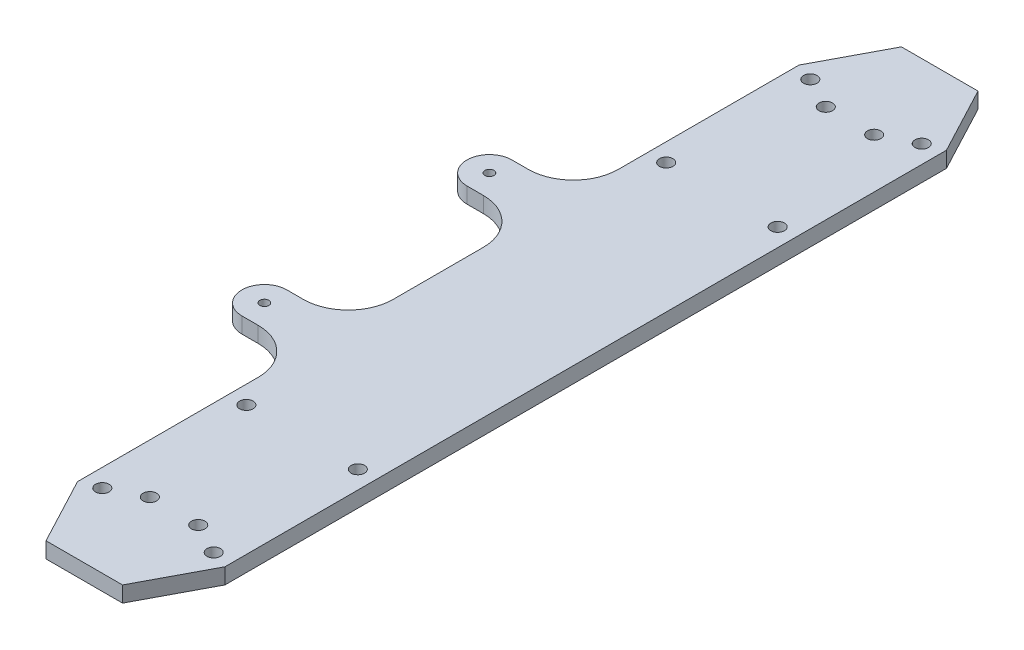
from build123d import *

# Parameters (mm, degrees)
SKETCH1_W               = 32.75
SKETCH1_H               = 190
BOSS_EXTRUDE1_DEPTH     = 3.5
SKETCH3_R               = 1.5
CUT_EXTRUDE1_DEPTH      = 97.46445265
MIRROR2_COPY_1_SKETCH_R = 1.5
MIRROR2_COPY_1_DEPTH    = 97.46445265
SKETCH4_R               = 1.5
CUT_EXTRUDE2_DEPTH      = 97.46445265
MIRROR4_COPY_1_SKETCH_R = 1.5
MIRROR4_COPY_1_DEPTH    = 97.46445265
BOSS_EXTRUDE2_DEPTH     = 3.5
FILLET1_R               = 10
FILLET2_R               = 10
FILLET5_R               = 10
FILLET6_R               = 10
MIRROR14_COPY_1_DEPTH   = 3.5
FILLET7_R               = 10
FILLET8_R               = 10
CUT_EXTRUDE3_DEPTH      = 102.304491633


with BuildPart() as part:
    # Sketch1 → Boss-Extrude1 (new body)
    with BuildSketch(Plane(origin=(0, 0, 0), x_dir=(1, 0, 0), z_dir=(0, 1, 0))):
        Rectangle(SKETCH1_W, SKETCH1_H)
    extrude(amount=BOSS_EXTRUDE1_DEPTH)

    # Sketch3 → Cut-Extrude1 (cut, through all)
    with BuildSketch(Plane(origin=(0, 3.5, 0), x_dir=(1, 0, 0), z_dir=(0, 1, 0))):
        with Locations(Location((-12.375, -46.625, 0), (0, 0, 270))):
            Circle(SKETCH3_R)
        with Locations(Location((-12.375, -78.625, 0), (0, 0, 270))):
            Circle(SKETCH3_R)
        Polygon((-16.375, -95), (-8.5, -95), (-16.375, -80.125), align=None)
    cut_extrude1 = extrude(amount=-CUT_EXTRUDE1_DEPTH, mode=Mode.SUBTRACT)

    # Mirror1: Cut-Extrude1 across plane
    add(cut_extrude1.mirror(Plane(origin=(0, 0, 0), x_dir=(0, 0, 1), z_dir=(1, 0, 0))), mode=Mode.SUBTRACT)

    # Mirror2: Cut-Extrude1 across plane
    add(cut_extrude1.mirror(Plane.XY), mode=Mode.SUBTRACT)

    # Mirror2 copy 1 sketch → Mirror2 copy 1 (cut, through all)
    with BuildSketch(Plane(origin=(0, 3.5, 0), x_dir=(-1, 0, 0), z_dir=(0, 1, 0))):
        with Locations(Location((-12.375, -46.625, 0), (0, 0, 270))):
            Circle(MIRROR2_COPY_1_SKETCH_R)
        with Locations(Location((-12.375, -78.625, 0), (0, 0, 270))):
            Circle(MIRROR2_COPY_1_SKETCH_R)
        Polygon((-16.375, -95), (-8.5, -95), (-16.375, -80.125), align=None)
    extrude(amount=-MIRROR2_COPY_1_DEPTH, mode=Mode.SUBTRACT)

    # Sketch4 → Cut-Extrude2 (cut, through all)
    with BuildSketch(Plane(origin=(0, 3.5, 0), x_dir=(1, 0, 0), z_dir=(0, 1, 0))):
        with Locations(Location((5.375, -75.065, 0), (0, 0, 270))):
            Circle(SKETCH4_R)
    cut_extrude2 = extrude(amount=-CUT_EXTRUDE2_DEPTH, mode=Mode.SUBTRACT)

    # Mirror3: Cut-Extrude2 across plane
    add(cut_extrude2.mirror(Plane(origin=(0, 0, 0), x_dir=(0, 0, 1), z_dir=(1, 0, 0))), mode=Mode.SUBTRACT)

    # Mirror4: Cut-Extrude2 across plane
    add(cut_extrude2.mirror(Plane.XY), mode=Mode.SUBTRACT)

    # Mirror4 copy 1 sketch → Mirror4 copy 1 (cut, through all)
    with BuildSketch(Plane(origin=(0, 3.5, 0), x_dir=(-1, 0, 0), z_dir=(0, 1, 0))):
        with Locations(Location((5.375, -75.065, 0), (0, 0, 270))):
            Circle(MIRROR4_COPY_1_SKETCH_R)
    extrude(amount=-MIRROR4_COPY_1_DEPTH, mode=Mode.SUBTRACT)

    # Sketch5 → Boss-Extrude2 (add)
    with BuildSketch(Plane.XZ):
        with BuildLine():
            Line((17.375, 29.995), (16.375, 29.995))
            Line((16.375, 29.995), (16.375, 24.995))
            Line((16.375, 24.995), (16.375, 19.995))
            Line((16.375, 19.995), (30.005, 19.995))
            ThreePointArc((30.005, 19.995), (35.005, 24.995), (30.005, 29.995))
            Line((30.005, 29.995), (17.375, 29.995))
        make_face()
        with BuildLine():
            ThreePointArc((31.005, 24.995), (30.005, 23.995), (29.005, 24.995))
            ThreePointArc((29.005, 24.995), (30.005, 25.995), (31.005, 24.995))
        make_face(mode=Mode.SUBTRACT)
    boss_extrude2 = extrude(amount=-BOSS_EXTRUDE2_DEPTH)

    # Fillet1
    fillet1_edges = [part.edges().sort_by_distance(p)[0] for p in [
        (16.375, 1.75, 29.995),
    ]]
    fillet(fillet1_edges, radius=FILLET1_R)

    # Fillet2
    fillet2_edges = [part.edges().sort_by_distance(p)[0] for p in [
        (16.375, 1.75, 19.995),
    ]]
    fillet(fillet2_edges, radius=FILLET2_R)

    # Mirror13: Boss-Extrude2 across plane
    add(boss_extrude2.mirror(Plane(origin=(0, 0, 0), x_dir=(0, 0, 1), z_dir=(1, 0, 0))))

    # Fillet5
    fillet5_edges = [part.edges().sort_by_distance(p)[0] for p in [
        (-16.375, 1.75, 29.995),
    ]]
    fillet(fillet5_edges, radius=FILLET5_R)

    # Fillet6
    fillet6_edges = [part.edges().sort_by_distance(p)[0] for p in [
        (-16.375, 1.75, 19.995),
    ]]
    fillet(fillet6_edges, radius=FILLET6_R)

    # Mirror14: Boss-Extrude2 across plane
    add(boss_extrude2.mirror(Plane.XY))

    # Mirror14 copy 1 sketch → Mirror14 copy 1 (add)
    with BuildSketch(Plane(origin=(0, 0, 0), x_dir=(-1, 0, 0), z_dir=(0, -1, 0))):
        with BuildLine():
            Line((17.375, 29.995), (16.375, 29.995))
            Line((16.375, 29.995), (16.375, 24.995))
            Line((16.375, 24.995), (16.375, 19.995))
            Line((16.375, 19.995), (30.005, 19.995))
            ThreePointArc((30.005, 19.995), (35.005, 24.995), (30.005, 29.995))
            Line((30.005, 29.995), (17.375, 29.995))
        make_face()
        with BuildLine():
            ThreePointArc((31.005, 24.995), (30.005, 23.995), (29.005, 24.995))
            ThreePointArc((29.005, 24.995), (30.005, 25.995), (31.005, 24.995))
        make_face(mode=Mode.SUBTRACT)
    extrude(amount=-MIRROR14_COPY_1_DEPTH)

    # Fillet7
    fillet7_edges = [part.edges().sort_by_distance(p)[0] for p in [
        (-16.375, 1.75, -29.995),
    ]]
    fillet(fillet7_edges, radius=FILLET7_R)

    # Fillet8
    fillet8_edges = [part.edges().sort_by_distance(p)[0] for p in [
        (-16.375, 1.75, -19.995),
    ]]
    fillet(fillet8_edges, radius=FILLET8_R)

    # Sketch6 → Cut-Extrude3 (cut, through all)
    with BuildSketch(Plane(origin=(0, 3.5, 0), x_dir=(1, 0, 0), z_dir=(0, 1, 0))):
        Polygon((16.375, 5), (16.375, 44.924773713), (47.716486095, 44.924773713), (47.716486095, -55.8941685), (16.375, -55.8941685), align=None)
    extrude(amount=-CUT_EXTRUDE3_DEPTH, mode=Mode.SUBTRACT)


solid = part.part
